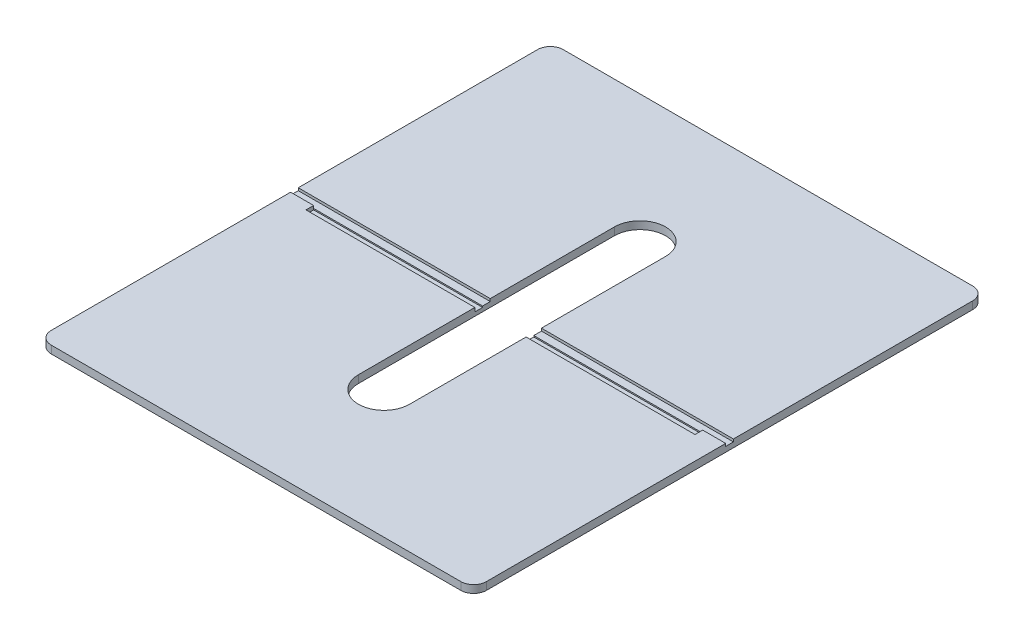
from build123d import *

# Parameters (mm, degrees)
EXTRUDE_1_DEPTH          = 1.5
CUT_EXTRUDE_1_DEPTH      = 132.278330276
CUT_EXTRUDE_1_DEPTH_BACK = 1.5
SKETCH_3_W               = 152
SKETCH_3_H               = 3
CUT_EXTRUDE_2_DEPTH      = 1


with BuildPart() as part:
    # Эскиз1 → Бобышка-Вытянуть1 (new, symmetric)
    with BuildSketch(Plane(origin=(0, 0, 0), x_dir=(1, 0, 0), z_dir=(0, 1, 0))):
        with BuildLine():
            Line((-80, 100), (80, 100))
            ThreePointArc((80, 100), (83.535533906, 98.535533906), (85, 95))
            Line((85, 95), (85, -95))
            ThreePointArc((85, -95), (83.535533906, -98.535533906), (80, -100))
            Line((80, -100), (-80, -100))
            ThreePointArc((-80, -100), (-83.535533906, -98.535533906), (-85, -95))
            Line((-85, -95), (-85, 95))
            ThreePointArc((-85, 95), (-83.535533906, 98.535533906), (-80, 100))
        make_face()
        with BuildLine():
            Line((10, 50), (10, -50))
            ThreePointArc((10, -50), (0, -60), (-10, -50))
            Line((-10, -50), (-10, 50))
            ThreePointArc((-10, 50), (0, 60), (10, 50))
        make_face(mode=Mode.SUBTRACT)
    extrude(amount=EXTRUDE_1_DEPTH, both=True)

    # Эскиз3 → Вырез-Вытянуть1 (cut, two sides: drawn at the far end of the back side and taken through both)
    with BuildSketch(Plane(origin=(0, 1.5, 0), x_dir=(1, 0, 0), z_dir=(0, 1, 0)).offset(-CUT_EXTRUDE_1_DEPTH_BACK)):
        with Locations((0, -3)):
            Rectangle(SKETCH_3_W, SKETCH_3_H)
    extrude(amount=CUT_EXTRUDE_1_DEPTH + CUT_EXTRUDE_1_DEPTH_BACK, mode=Mode.SUBTRACT)

    # Эскиз4 → Вырез-Вытянуть2 (cut)
    with BuildSketch(Plane(origin=(0, 1.5, 0), x_dir=(1, 0, 0), z_dir=(0, 1, 0))):
        with BuildLine():
            Line((88.228937258, -1.5), (-88.228937258, -1.5))
            ThreePointArc((-88.228937258, -1.5), (-89.728937258, 0), (-88.228937258, 1.5))
            Line((-88.228937258, 1.5), (88.228937258, 1.5))
            ThreePointArc((88.228937258, 1.5), (89.728937258, 0), (88.228937258, -1.5))
        make_face()
    extrude(amount=-CUT_EXTRUDE_2_DEPTH, mode=Mode.SUBTRACT)


solid = part.part
